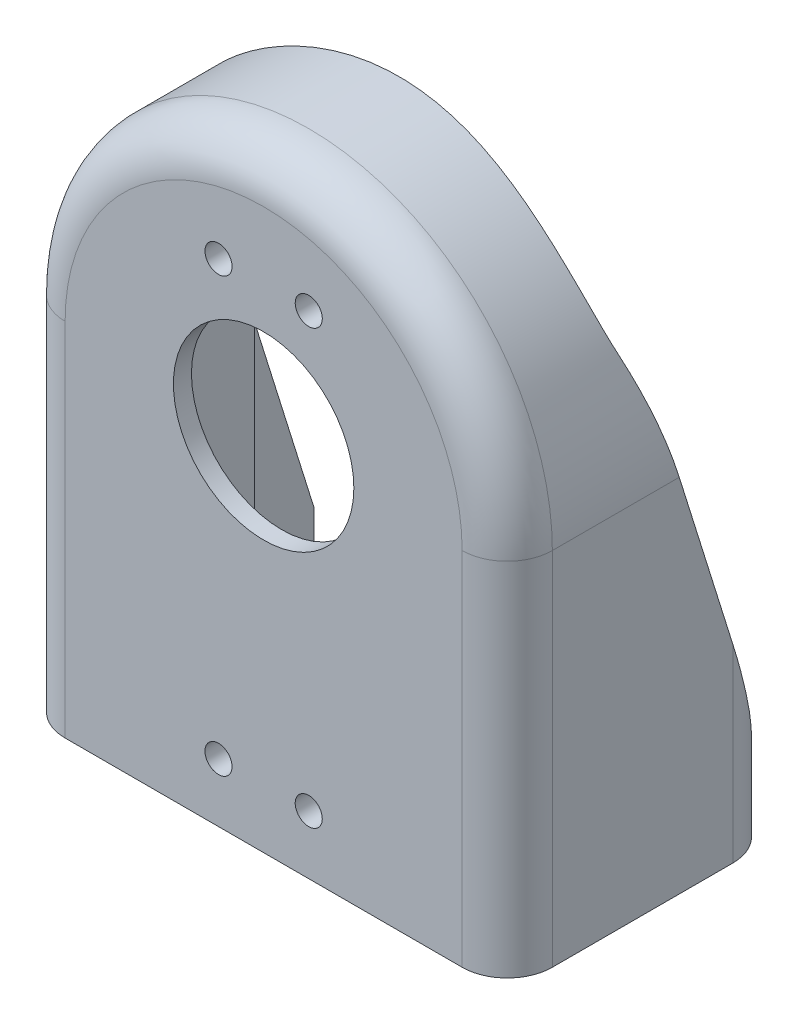
from build123d import *

# Parameters (mm, degrees)
BOSS_EXTRUDE1_DEPTH     = 30
SKETCH3_4_R             = 10
BOSS_EXTRUDE2_DEPTH     = 10
CUT_EXTRUDE2_DEPTH      = 62.951594007
CUT_EXTRUDE2_DEPTH_BACK = 62.951594007
CUT_EXTRUDE3_START      = -8
SKETCH6_W               = 22
SKETCH6_H               = 41
SKETCH6_R               = 10
CUT_EXTRUDE3_DEPTH      = 8
SKETCH6_3_R             = 1.5
CUT_EXTRUDE4_DEPTH      = 58.775427431
CUT_EXTRUDE5_DEPTH      = 79.217645188
SKETCH8_R               = 1.5
CUT_EXTRUDE6_DEPTH      = 76.663729872
FILLET1_R               = 5


with BuildPart() as part:
    # Sketch3 → Boss-Extrude1 (new body)
    with BuildSketch(Plane.XY):
        with BuildLine():
            Line((-27, 20), (-27, -20))
            Line((-27, -20), (27, -20))
            Line((27, -20), (27, 20))
            ThreePointArc((27, 20), (0, 47), (-27, 20))
        make_face()
        with BuildLine():
            Line((24, -17), (-24, -17))
            Line((-24, -17), (-24, 20))
            ThreePointArc((-24, 20), (0, 44), (24, 20))
            Line((24, 20), (24, -17))
        make_face(mode=Mode.SUBTRACT)
    extrude(amount=-BOSS_EXTRUDE1_DEPTH)

    # Sketch3<4> → Boss-Extrude2 (add)
    with BuildSketch(Plane.XY):
        with BuildLine():
            Line((-24, 20), (-24, -17))
            Line((-24, -17), (24, -17))
            Line((24, -17), (24, 20))
            ThreePointArc((24, 20), (0, 44), (-24, 20))
        make_face()
        with Locations((0, 20)):
            Circle(SKETCH3_4_R, mode=Mode.SUBTRACT)
    extrude(amount=-BOSS_EXTRUDE2_DEPTH)

    # Sketch5 → Cut-Extrude2 (cut, two sides: drawn at the far end of the back side and taken through both)
    with BuildSketch(Plane(origin=(0, 0, 0), x_dir=(0, 0, -1), z_dir=(1, 0, 0)).offset(-CUT_EXTRUDE2_DEPTH_BACK)):
        with BuildLine():
            Line((15.255034443, 32.183889783), (30, -15))
            Line((30, -15), (30, 47))
            Line((30, 47), (15, 47))
            ThreePointArc((15, 47), (14.181044165, 40.740478791), (14.690093427, 34.448168938))
            ThreePointArc((14.690093427, 34.448168938), (14.93950997, 33.307782347), (15.255034443, 32.183889783))
        make_face()
    extrude(amount=CUT_EXTRUDE2_DEPTH + CUT_EXTRUDE2_DEPTH_BACK, mode=Mode.SUBTRACT)

    # Sketch6 → Cut-Extrude3 (cut)
    with BuildSketch(Plane(origin=(0, 0, -10), x_dir=(-1, 0, 0), z_dir=(0, 0, -1)).offset(CUT_EXTRUDE3_START)):
        with Locations((0, 10.5)):
            Rectangle(SKETCH6_W, SKETCH6_H)
        with Locations((0, 20)):
            Circle(SKETCH6_R, mode=Mode.SUBTRACT)
    extrude(amount=CUT_EXTRUDE3_DEPTH, mode=Mode.SUBTRACT)

    # Sketch6<3> → Cut-Extrude4 (cut, through all)
    with BuildSketch(Plane(origin=(0, 0, -10), x_dir=(-1, 0, 0), z_dir=(0, 0, -1))):
        with Locations((-5, 34.5)):
            Circle(SKETCH6_3_R)
        with Locations((5, 34.5)):
            Circle(SKETCH6_3_R)
        with Locations((5, -13.5)):
            Circle(SKETCH6_3_R)
        with Locations((-5, -13.5)):
            Circle(SKETCH6_3_R)
    extrude(amount=-CUT_EXTRUDE4_DEPTH, mode=Mode.SUBTRACT)

    # Sketch7 → Cut-Extrude5 (cut, through all)
    with BuildSketch(Plane.XZ.offset(20)):
        with BuildLine():
            Line((-27, -25), (-27, -30))
            Line((-27, -30), (-22, -30))
            ThreePointArc((-22, -30), (-25.535533906, -28.535533906), (-27, -25))
        make_face()
        with BuildLine():
            Line((22, -30), (27, -30))
            Line((27, -30), (27, -25))
            ThreePointArc((27, -25), (25.535533906, -28.535533906), (22, -30))
        make_face()
    extrude(amount=-CUT_EXTRUDE5_DEPTH, mode=Mode.SUBTRACT)

    # Sketch8 → Cut-Extrude6 (cut, through all)
    with BuildSketch(Plane(origin=(0, -17, 0), x_dir=(1, 0, 0), z_dir=(0, 1, 0))):
        with Locations((-20, 26)):
            Circle(SKETCH8_R)
        with Locations((20, 26)):
            Circle(SKETCH8_R)
        with Locations((20, 14)):
            Circle(SKETCH8_R)
        with Locations((-20, 14)):
            Circle(SKETCH8_R)
    extrude(amount=-CUT_EXTRUDE6_DEPTH, mode=Mode.SUBTRACT)

    # Fillet1
    fillet1_edges = [part.edges().sort_by_distance(p)[0] for p in [
        (-27, 0, 0),
        (0, 47, 0),
        (27, 0, 0),
    ]]
    fillet(fillet1_edges, radius=FILLET1_R)


solid = part.part
